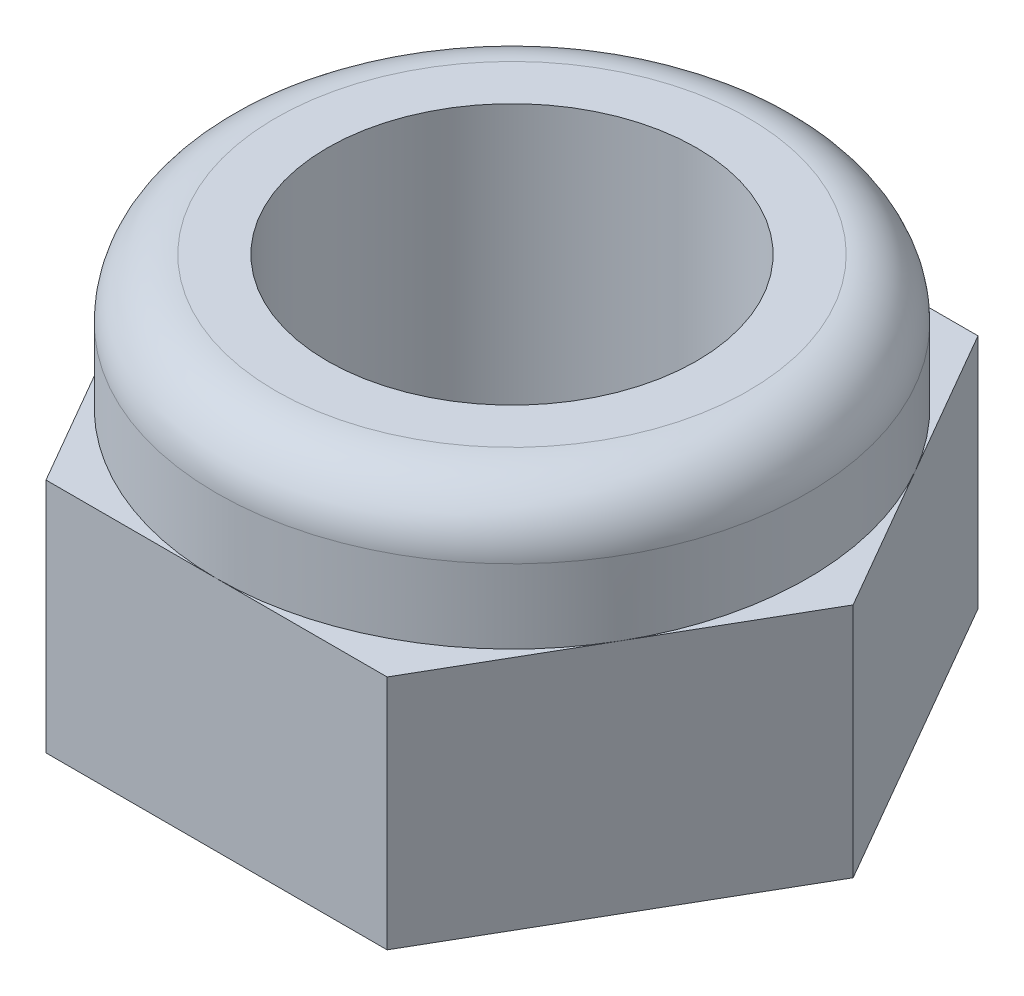
from build123d import *

# Parameters (mm, degrees)
BOSS_EXTRUDE1_DEPTH = 3.2
SKETCH2_R           = 4
BOSS_EXTRUDE2_DEPTH = 1.8
SKETCH3_R           = 2.5
CUT_EXTRUDE1_DEPTH  = 8.895146188
FILLET1_R           = 0.8


with BuildPart() as part:
    # Sketch1 → Boss-Extrude1 (new body)
    with BuildSketch(Plane(origin=(0, 0, 0), x_dir=(1, 0, 0), z_dir=(0, 1, 0))):
        Polygon((4.618802154, 0), (2.309401077, 4), (-2.309401077, 4), (-4.618802154, 0), (-2.309401077, -4), (2.309401077, -4), align=None)
    extrude(amount=BOSS_EXTRUDE1_DEPTH)

    # Sketch2 → Boss-Extrude2 (add)
    with BuildSketch(Plane(origin=(0, 3.2, 0), x_dir=(1, 0, 0), z_dir=(0, 1, 0))):
        with Locations(Location((0, 0, 0), (0, 0, 270))):
            Circle(SKETCH2_R)
    extrude(amount=BOSS_EXTRUDE2_DEPTH)

    # Sketch3 → Cut-Extrude1 (cut, through all)
    with BuildSketch(Plane(origin=(0, 5, 0), x_dir=(1, 0, 0), z_dir=(0, 1, 0))):
        with Locations(Location((0, 0, 0), (0, 0, 270))):
            Circle(SKETCH3_R)
    extrude(amount=-CUT_EXTRUDE1_DEPTH, mode=Mode.SUBTRACT)

    # Fillet1
    fillet1_edges = [part.edges().sort_by_distance(p)[0] for p in [
        (0, 5, -4),
    ]]
    fillet(fillet1_edges, radius=FILLET1_R)


solid = part.part
